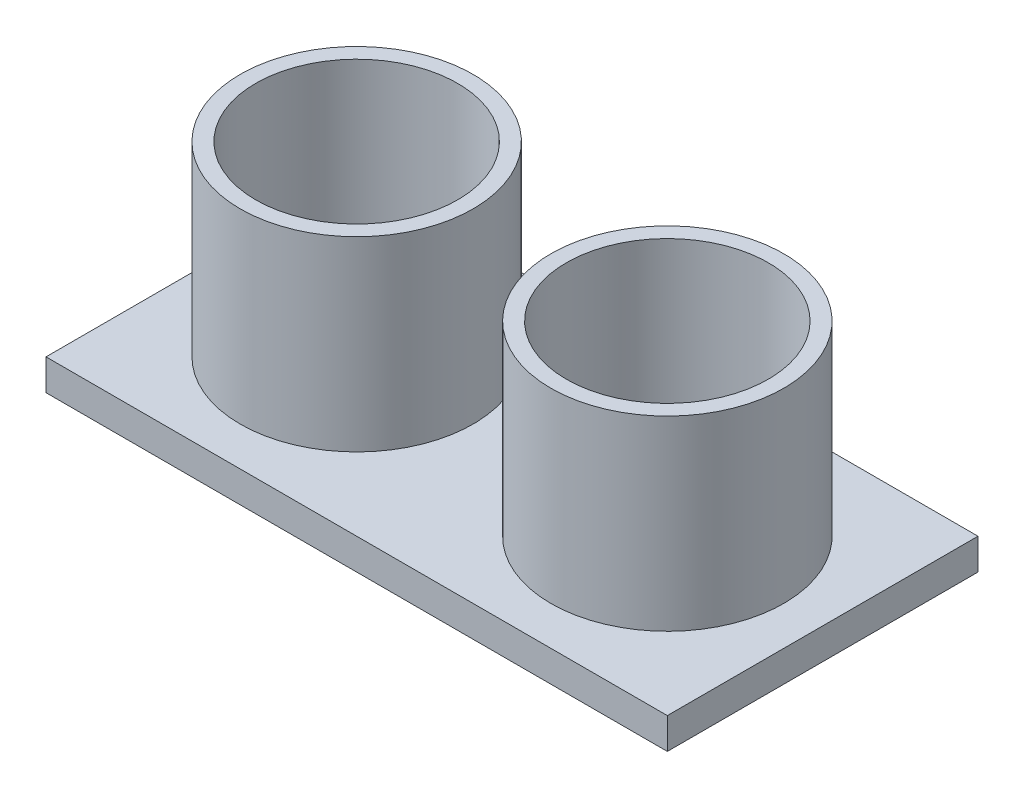
from build123d import *

# Parameters (mm, degrees)
SKETCH1_W           = 40
SKETCH1_H           = 20
BOSS_EXTRUDE1_DEPTH = 2
SKETCH2_R           = 7.5
BOSS_EXTRUDE2_DEPTH = 12
SKETCH3_R           = 6.5
CUT_EXTRUDE1_DEPTH  = 12
SKETCH7_R           = 6.5
CUT_EXTRUDE2_DEPTH  = 12
BOSS_EXTRUDE3_DEPTH = 2


with BuildPart() as part:
    # Sketch1 → Boss-Extrude1 (new body)
    with BuildSketch(Plane(origin=(0, 0, 0), x_dir=(1, 0, 0), z_dir=(0, 1, 0))):
        Rectangle(SKETCH1_W, SKETCH1_H)
    extrude(amount=BOSS_EXTRUDE1_DEPTH)

    # Sketch2 → Boss-Extrude2 (add)
    with BuildSketch(Plane(origin=(0, 2, 0), x_dir=(1, 0, 0), z_dir=(0, 1, 0))):
        with Locations(Location((-10, 0, 0), (0, 0, 270))):
            Circle(SKETCH2_R)
        with Locations(Location((10, 0, 0), (0, 0, 270))):
            Circle(SKETCH2_R)
    extrude(amount=BOSS_EXTRUDE2_DEPTH)

    # Sketch3 → Cut-Extrude1 (cut)
    with BuildSketch(Plane(origin=(0, 14, 0), x_dir=(1, 0, 0), z_dir=(0, 1, 0))):
        with Locations(Location((-10, 0, 0), (0, 0, 270))):
            Circle(SKETCH3_R)
    extrude(amount=-CUT_EXTRUDE1_DEPTH, mode=Mode.SUBTRACT)

    # Sketch7 → Cut-Extrude2 (cut)
    with BuildSketch(Plane(origin=(0, 14, 0), x_dir=(1, 0, 0), z_dir=(0, 1, 0))):
        with Locations(Location((10, 0, 0), (0, 0, 270))):
            Circle(SKETCH7_R)
    extrude(amount=-CUT_EXTRUDE2_DEPTH, mode=Mode.SUBTRACT)

    # Sketch9 → Boss-Extrude3 (add)
    with BuildSketch(Plane(origin=(0, 2, 0), x_dir=(1, 0, 0), z_dir=(0, 1, 0))):
        with BuildLine():
            Line((-3, 9), (3, 9))
            ThreePointArc((3, 9), (4.5, 7.5), (3, 6))
            Line((3, 6), (-3, 6))
            ThreePointArc((-3, 6), (-4.5, 7.5), (-3, 9))
        make_face()
    extrude(amount=BOSS_EXTRUDE3_DEPTH)


solid = part.part
